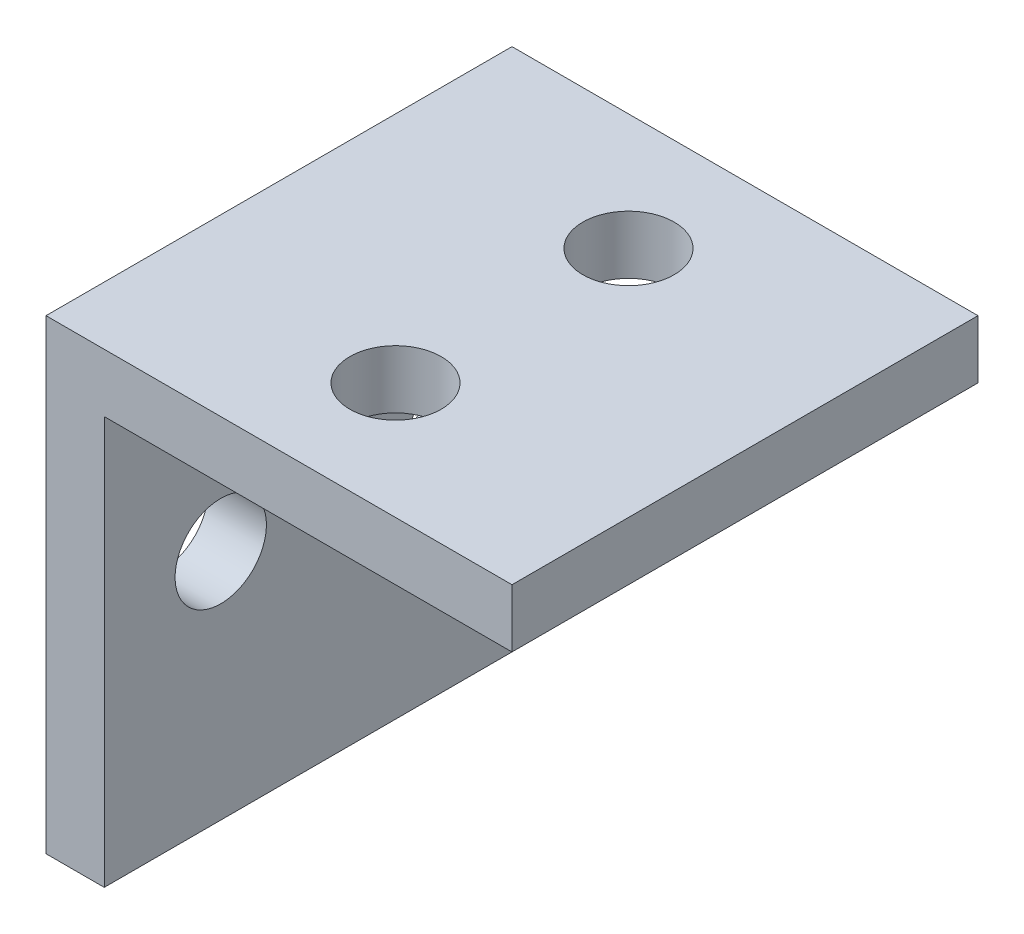
from build123d import *

# Parameters (mm, degrees)
BOSS_EXTRUDE1_DEPTH = 25.4
SKETCH5_R           = 2.4892
CUT_EXTRUDE1_DEPTH  = 43.240627659
SKETCH6_R           = 2.4892
CUT_EXTRUDE2_DEPTH  = 43.240627659


with BuildPart() as part:
    # Sketch2 → Boss-Extrude1 (new body)
    with BuildSketch(Plane.XY):
        Polygon((0, 0), (0, -25.4), (3.175, -25.4), (3.175, -3.175), (25.4, -3.175), (25.4, 0), align=None)
    extrude(amount=BOSS_EXTRUDE1_DEPTH)

    # Sketch5 → Cut-Extrude1 (cut, through all)
    with BuildSketch(Plane(origin=(3.175, 0, 0), x_dir=(0, 0, -1), z_dir=(1, 0, 0))):
        with Locations(Location((-6.35, -12.7, 0), (0, 0, 90))):
            Circle(SKETCH5_R)
        with Locations(Location((-19.05, -12.7, 0), (0, 0, 90))):
            Circle(SKETCH5_R)
        with Locations((-31.75, -12.7)):
            Circle(SKETCH5_R)
        with Locations((-44.45, -12.7)):
            Circle(SKETCH5_R)
    extrude(amount=-CUT_EXTRUDE1_DEPTH, mode=Mode.SUBTRACT)

    # Sketch6 → Cut-Extrude2 (cut, through all)
    with BuildSketch(Plane.XZ.offset(3.175)):
        with Locations((12.7, 6.35)):
            Circle(SKETCH6_R)
        with Locations((12.7, 19.05)):
            Circle(SKETCH6_R)
        with Locations((12.7, 31.75)):
            Circle(SKETCH6_R)
        with Locations((12.7, 44.45)):
            Circle(SKETCH6_R)
    extrude(amount=-CUT_EXTRUDE2_DEPTH, mode=Mode.SUBTRACT)


solid = part.part
